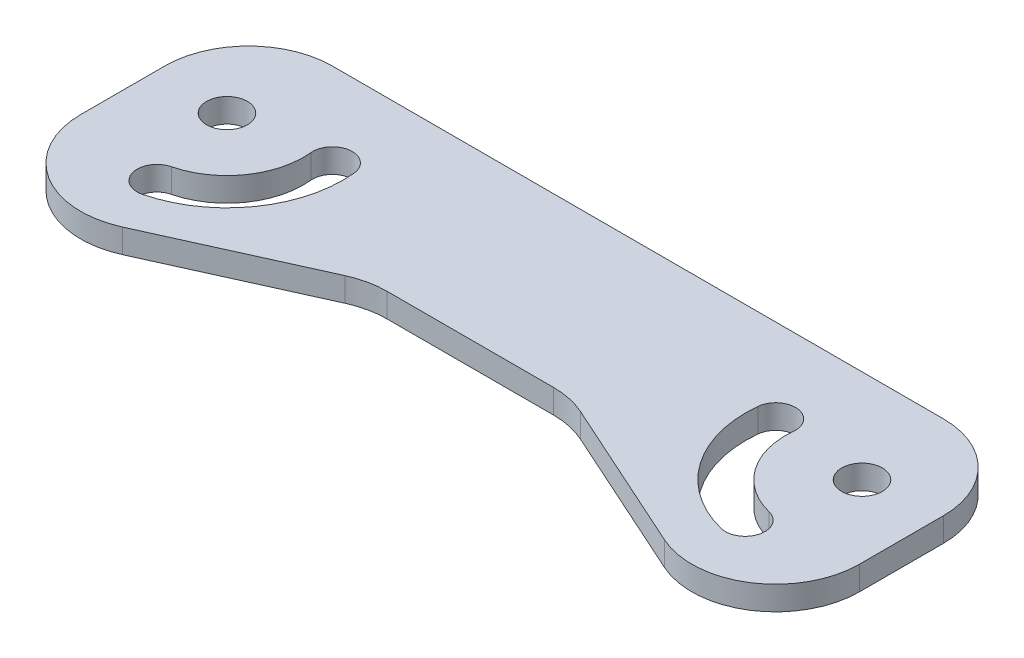
from build123d import *

# Parameters (mm, degrees)
SKETCH1_W            = 65
SKETCH1_H            = 14
BOSS_EXTRUDE1_DEPTH  = 2
BOSS_EXTRUDE2_DEPTH  = 2
M3_CLEARANCE_HOLE1_D = 3.4
CUT_EXTRUDE1_DEPTH   = 38.133172501
FILLET1_R            = 7


with BuildPart() as part:
    # Sketch1 → Boss-Extrude1 (new body)
    with BuildSketch(Plane(origin=(0, 0, 0), x_dir=(1, 0, 0), z_dir=(0, 1, 0))):
        Rectangle(SKETCH1_W, SKETCH1_H)
    extrude(amount=BOSS_EXTRUDE1_DEPTH)

    # Sketch5 → Boss-Extrude2 (add)
    with BuildSketch(Plane(origin=(0, 2, 0), x_dir=(1, 0, 0), z_dir=(0, 1, 0))):
        Polygon((-32.5, -7), (-32.5, -17.85), (-8.45, -7), align=None)
        Polygon((8.45, -7), (32.5, -7), (32.5, -17.85), align=None)
    extrude(amount=-BOSS_EXTRUDE2_DEPTH)

    # M3 Clearance Hole1 (through all)
    with Locations(Plane(origin=(0, 2, 0), x_dir=(1, 0, 0), z_dir=(0, 1, 0))):
        with Locations((-26.5, -0.8), (26.5, -0.8)):
            Hole(M3_CLEARANCE_HOLE1_D / 2)

    # Sketch4 → Cut-Extrude1 (cut, through all)
    with BuildSketch(Plane(origin=(0, 2, 0), x_dir=(1, 0, 0), z_dir=(0, 1, 0))):
        with BuildLine():
            ThreePointArc((-24.14980848, -10.200572933), (-18.574782967, -6.375401925), (-16.858188636, 0.164181136))
            ThreePointArc((-16.858188636, 0.164181136), (-18.664181136, 1.641811364), (-20.141811364, -0.164181136))
            ThreePointArc((-20.141811364, -0.164181136), (-21.273800865, -4.476638541), (-24.950191053, -6.999106435))
            ThreePointArc((-24.950191053, -6.999106435), (-26.150733249, -9.000031029), (-24.14980848, -10.200572933))
        make_face()
        with BuildLine():
            ThreePointArc((24.14980848, -10.200572933), (18.574782967, -6.375401925), (16.858188636, 0.164181136))
            ThreePointArc((16.858188636, 0.164181136), (18.664181136, 1.641811364), (20.141811364, -0.164181136))
            ThreePointArc((20.141811364, -0.164181136), (21.273800865, -4.476638541), (24.950191053, -6.999106435))
            ThreePointArc((24.950191053, -6.999106435), (26.150733249, -9.000031029), (24.14980848, -10.200572933))
        make_face()
    extrude(amount=-CUT_EXTRUDE1_DEPTH, mode=Mode.SUBTRACT)

    # Fillet1
    fillet1_edges = [part.edges().sort_by_distance(p)[0] for p in [
        (32.5, 1, -7),
        (-32.5, 1, -7),
        (32.5, 1, 17.85),
        (8.45, 1, 7),
        (-8.45, 1, 7),
        (-32.5, 1, 17.85),
    ]]
    fillet(fillet1_edges, radius=FILLET1_R)


solid = part.part
